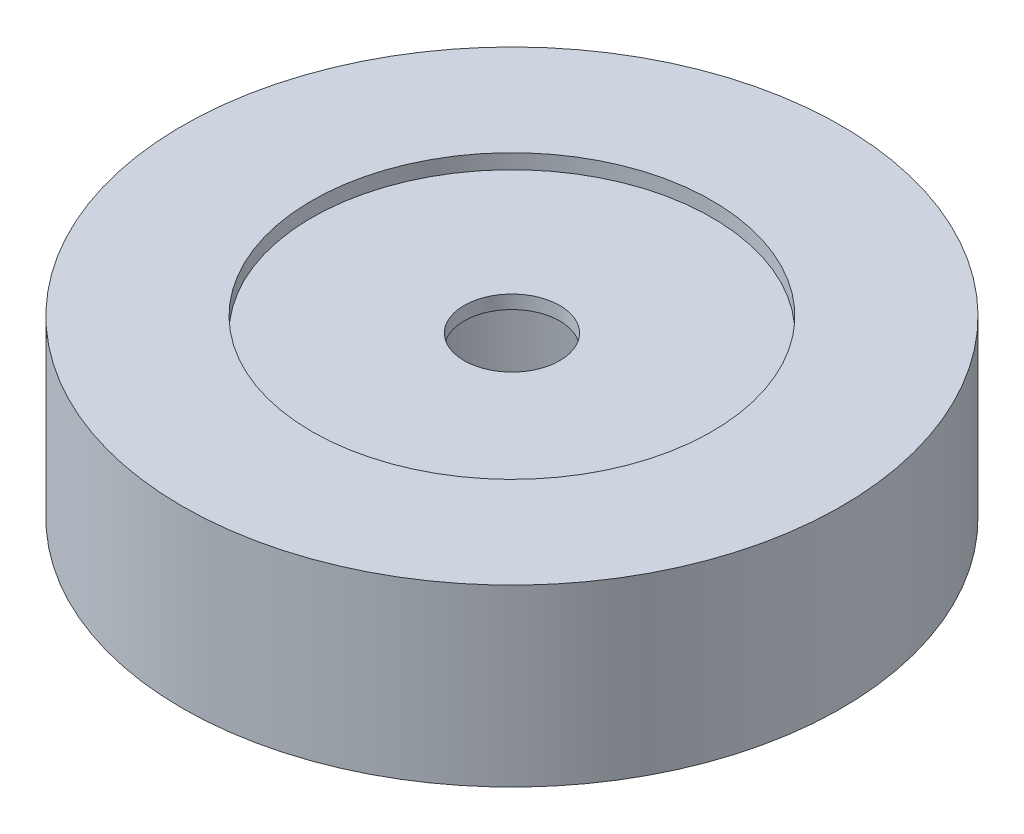
from build123d import *

# Parameters (mm, degrees)
SKETCH1_R           = 227.33
SKETCH1_R_2         = 33
BOSS_EXTRUDE1_DEPTH = 120.65
SKETCH2_R           = 120.5
CUT_EXTRUDE1_DEPTH  = 101.22
SKETCH3_R           = 138
CUT_EXTRUDE2_DEPTH  = 10.16


with BuildPart() as part:
    # Sketch1 → Boss-Extrude1 (new body)
    with BuildSketch(Plane(origin=(0, 0, 0), x_dir=(1, 0, 0), z_dir=(0, 1, 0))):
        with Locations(Location((0, 0, 0), (0, 0, 270))):
            Circle(SKETCH1_R)
        with Locations(Location((0, 0, 0), (0, 0, 270))):
            Circle(SKETCH1_R_2, mode=Mode.SUBTRACT)
    extrude(amount=BOSS_EXTRUDE1_DEPTH)

    # Sketch2 → Cut-Extrude1 (cut)
    with BuildSketch(Plane.XZ):
        with Locations(Location((0, 0, 0), (0, 0, 270))):
            Circle(SKETCH2_R)
    extrude(amount=-CUT_EXTRUDE1_DEPTH, mode=Mode.SUBTRACT)

    # Sketch3 → Cut-Extrude2 (cut)
    with BuildSketch(Plane(origin=(0, 120.65, 0), x_dir=(1, 0, 0), z_dir=(0, 1, 0))):
        with Locations(Location((0, 0, 0), (0, 0, 270))):
            Circle(SKETCH3_R)
    extrude(amount=-CUT_EXTRUDE2_DEPTH, mode=Mode.SUBTRACT)


solid = part.part
